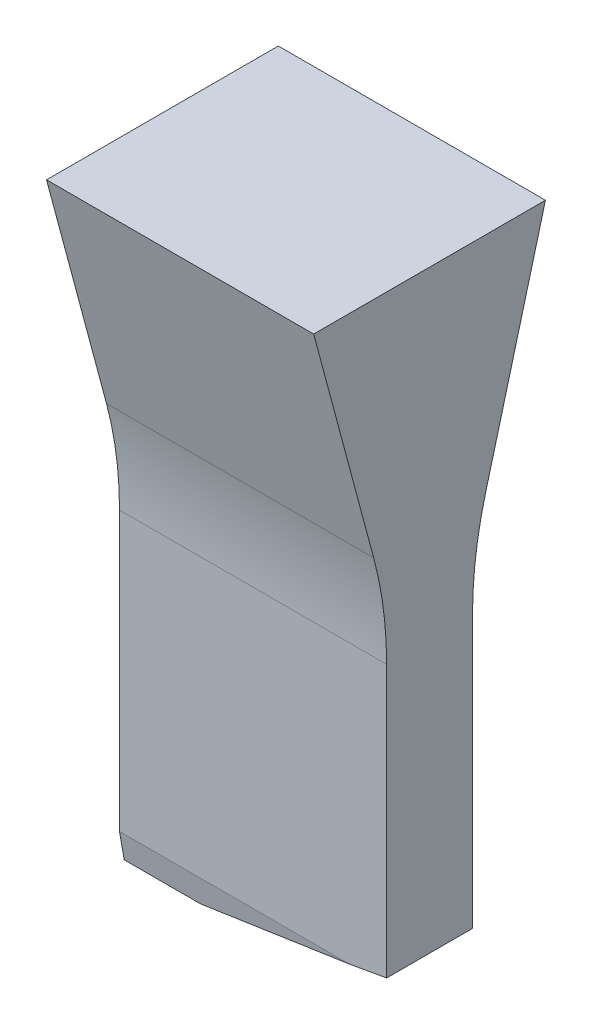
from build123d import *

# Parameters (mm, degrees)
TD_STD_FEATURE_DEPTH       = 21.0312
ISA_STD_FEATURE_DEPTH      = 22.061040395
ISA_STD_FEATURE_DEPTH_BACK = 22.061040395
BA_STD_FEATURE_DEPTH       = 22.061040395
BA_STD_FEATURE_DEPTH_BACK  = 22.061040395
VR_STD_FEATURE_DEPTH       = 22.061040395
VR_STD_FEATURE_DEPTH_BACK  = 22.061040395
SLB_STD_FEATURE_DEPTH      = 22.061040395
SLB_STD_FEATURE_DEPTH_BACK = 22.061040395


with BuildPart() as part:
    # td_std_sketch → td_std_feature (new body)
    with BuildSketch(Plane(origin=(0, 0, 0), x_dir=(1, 0, 0), z_dir=(0, 1, 0))):
        with BuildLine():
            Line((-0.37592, 0.697645113), (-0.37592, -0.697645113))
            ThreePointArc((-0.37592, -0.697645113), (0.79248, 0), (-0.37592, 0.697645113))
        make_face()
    extrude(amount=TD_STD_FEATURE_DEPTH)

    # isa_std_sketch → isa_std_feature (cut, two sides: drawn at the far end of the back side and taken through both)
    with BuildSketch(Plane(origin=(0, 0, 0), x_dir=(0, 0, -1), z_dir=(1, 0, 0)).offset(-ISA_STD_FEATURE_DEPTH_BACK)):
        Polygon((8.398066277, 47.339699483), (0.79248, 4.2062763), (0.0508, 0), (-0.0508, 0), (-0.79248, 4.2062763), (-8.398066277, 47.339699483), (-8.398066277, -40.25795204), (8.398066277, -40.25795204), align=None)
    extrude(amount=ISA_STD_FEATURE_DEPTH + ISA_STD_FEATURE_DEPTH_BACK, mode=Mode.SUBTRACT)

    # ba_std_sketch → ba_std_feature (cut, two sides: drawn at the far end of the back side and taken through both)
    with BuildSketch(Plane.XY.offset(-BA_STD_FEATURE_DEPTH_BACK)):
        Polygon((-51.59903187, -9.04993148), (-0.27432, 0), (-0.012169423, 0.04622422), (0.79248, 4.609617863), (9.84241148, 55.934329733), (85.581906017, -15.675992153), (24.140462667, -80.660253365), align=None)
    extrude(amount=BA_STD_FEATURE_DEPTH + BA_STD_FEATURE_DEPTH_BACK, mode=Mode.SUBTRACT)

    # vr_std_sketch → vr_std_feature (cut, two sides: drawn at the far end of the back side and taken through both)
    with BuildSketch(Plane(origin=(0, 0, 0), x_dir=(0, 0, -1), z_dir=(1, 0, 0)).offset(-VR_STD_FEATURE_DEPTH_BACK)):
        with BuildLine():
            Line((12.638111697, 47.42606773), (0.79248, 3.217568389))
            Line((0.79248, 3.217568389), (0.07445968, 0.537880075))
            ThreePointArc((0.07445968, 0.537880075), (0.06149601, 0.472707306), (0.05715, 0.4064))
            Line((0.05715, 0.4064), (0.05715, 0))
            Line((0.05715, 0), (-0.05715, 0))
            Line((-0.05715, 0), (-0.05715, 0.4064))
            ThreePointArc((-0.05715, 0.4064), (-0.06149601, 0.472707306), (-0.07445968, 0.537880075))
            Line((-0.07445968, 0.537880075), (-0.79248, 3.217568389))
            Line((-0.79248, 3.217568389), (-12.638111697, 47.42606773))
            Line((-12.638111697, 47.42606773), (-12.638111697, -44.109944949))
            Line((-12.638111697, -44.109944949), (12.638111697, -44.109944949))
            Line((12.638111697, -44.109944949), (12.638111697, 47.42606773))
        make_face()
    extrude(amount=VR_STD_FEATURE_DEPTH + VR_STD_FEATURE_DEPTH_BACK, mode=Mode.SUBTRACT)

    # slb_std_sketch → slb_std_feature (cut, two sides: drawn at the far end of the back side and taken through both)
    with BuildSketch(Plane.XY.offset(-SLB_STD_FEATURE_DEPTH_BACK)):
        with BuildLine():
            Line((-0.02032, -52.09380084), (-0.02032, 0))
            Line((-0.02032, 0), (-0.02032, 1.143))
            ThreePointArc((-0.02032, 1.143), (-0.018386907, 1.187275117), (-0.012602339, 1.231213274))
            Line((-0.012602339, 1.231213274), (0.79248, 5.797062104))
            Line((0.79248, 5.797062104), (9.838473584, 57.099441055))
            Line((9.838473584, 57.099441055), (113.603993376, 47.730703366))
            Line((113.603993376, 47.730703366), (103.745199792, -61.462538529))
            Line((103.745199792, -61.462538529), (-0.02032, -52.09380084))
        make_face()
    extrude(amount=SLB_STD_FEATURE_DEPTH + SLB_STD_FEATURE_DEPTH_BACK, mode=Mode.SUBTRACT)

    # std_right_cut
    split(bisect_by=Plane(origin=(0, 0.83566, 0), x_dir=(1, 0, 0), z_dir=(0, 1, 0)), keep=Keep.BOTTOM)


solid = part.part
